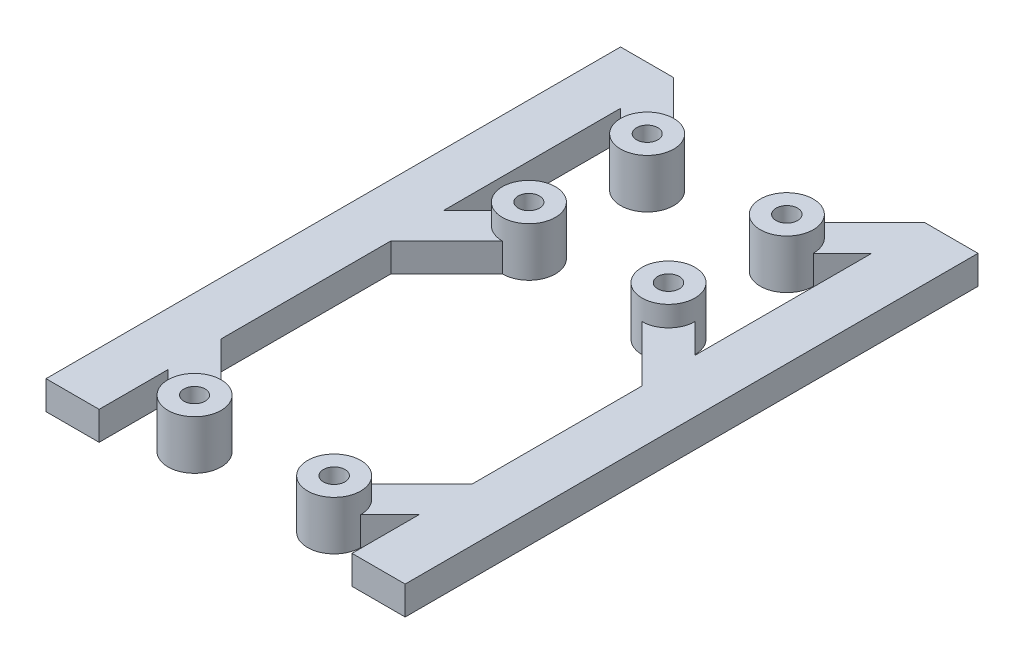
from build123d import *

# Parameters (mm, degrees)
SKETCH1_R              = 4.1275
SKETCH1_R_2            = 1.6764
BOSS_EXTRUDE1_DEPTH    = 3.175
BOSS_EXTRUDE1_2_DEPTH  = 3.175
BOSS_EXTRUDE1_3_DEPTH  = 3.175
BOSS_EXTRUDE1_4_DEPTH  = 3.175
BOSS_EXTRUDE1_5_DEPTH  = 3.175
BOSS_EXTRUDE1_6_DEPTH  = 3.175
BOSS_EXTRUDE1_7_DEPTH  = 3.175
BOSS_EXTRUDE1_8_DEPTH  = 3.175
BOSS_EXTRUDE1_9_DEPTH  = 3.175
BOSS_EXTRUDE1_10_DEPTH = 3.175
BOSS_EXTRUDE1_11_DEPTH = 3.175
BOSS_EXTRUDE1_12_DEPTH = 3.175
SKETCH2_R              = 1.6764
SKETCH2_R_2            = 1.597419346
BOSS_EXTRUDE2_DEPTH    = 4.445
SKETCH3_R              = 4.1275
SKETCH3_R_2            = 1.6764
BOSS_EXTRUDE3_DEPTH    = 6.35
SKETCH5_W              = 93.927077551
SKETCH5_H              = 52.017280011
CUT_EXTRUDE1_DEPTH     = 189.093566893
SKETCH6_W              = 99.512687727
SKETCH6_H              = 74.862867045
CUT_EXTRUDE3_DEPTH     = 189.006725097
SKETCH7_R              = 1.651
BOSS_EXTRUDE5_DEPTH    = 7.62
BOSS_EXTRUDE5_2_DEPTH  = 7.62
BOSS_EXTRUDE5_3_DEPTH  = 7.62
BOSS_EXTRUDE6_DEPTH    = 4.445
SKETCH10_W             = 53.220622609
SKETCH10_H             = 98.471007051
CUT_EXTRUDE4_DEPTH     = 139.402426653


with BuildPart() as part:
    # Sketch1 → Boss-Extrude1 (new body)
    with BuildSketch(Plane(origin=(0, 72.156669294, 0), x_dir=(-1, 0, 0), z_dir=(0, -1, 0))):
        with Locations(Location((-13.434351276, 13.879892008, 0), (0, 0, 90))):
            Circle(SKETCH1_R)
        with Locations(Location((-13.434351276, 13.879892008, 0), (0, 0, 90))):
            Circle(SKETCH1_R_2, mode=Mode.SUBTRACT)
    extrude(amount=BOSS_EXTRUDE1_DEPTH)



with BuildPart() as body_2:
    # Sketch1 → Boss-Extrude1 2 (new body)
    with BuildSketch(Plane(origin=(0, 72.156669294, 0), x_dir=(-1, 0, 0), z_dir=(0, -1, 0))):
        with Locations(Location((38.584848724, 13.879892008, 0), (0, 0, 90))):
            Circle(SKETCH1_R)
        with Locations(Location((38.584848724, 13.879892008, 0), (0, 0, 90))):
            Circle(SKETCH1_R_2, mode=Mode.SUBTRACT)
    extrude(amount=BOSS_EXTRUDE1_2_DEPTH)



with BuildPart() as body_3:
    # Sketch1 → Boss-Extrude1 3 (new body)
    with BuildSketch(Plane(origin=(0, 72.156669294, 0), x_dir=(-1, 0, 0), z_dir=(0, -1, 0))):
        with Locations(Location((-13.434351276, -38.088507992, 0), (0, 0, 90))):
            Circle(SKETCH1_R)
        with Locations(Location((-13.434351276, -38.088507992, 0), (0, 0, 90))):
            Circle(SKETCH1_R_2, mode=Mode.SUBTRACT)
    extrude(amount=BOSS_EXTRUDE1_3_DEPTH)


with BuildPart() as body_4:
    # Sketch1 → Boss-Extrude1 4 (new body)
    with BuildSketch(Plane(origin=(0, 72.156669294, 0), x_dir=(-1, 0, 0), z_dir=(0, -1, 0))):
        with Locations(Location((38.584848724, -38.088507992, 0), (0, 0, 90))):
            Circle(SKETCH1_R)
        with Locations(Location((38.584848724, -38.088507992, 0), (0, 0, 90))):
            Circle(SKETCH1_R_2, mode=Mode.SUBTRACT)
    extrude(amount=BOSS_EXTRUDE1_4_DEPTH)


with BuildPart() as body_5:
    # Sketch1 → Boss-Extrude1 5 (new body)
    with BuildSketch(Plane(origin=(0, 72.156669294, 0), x_dir=(-1, 0, 0), z_dir=(0, -1, 0))):
        with Locations(Location((-13.434351276, -56.478107992, 0), (0, 0, 90))):
            Circle(SKETCH1_R)
        with Locations(Location((-13.434351276, -56.478107992, 0), (0, 0, 90))):
            Circle(SKETCH1_R_2, mode=Mode.SUBTRACT)
    extrude(amount=BOSS_EXTRUDE1_5_DEPTH)


with BuildPart() as body_6:
    # Sketch1 → Boss-Extrude1 6 (new body)
    with BuildSketch(Plane(origin=(0, 72.156669294, 0), x_dir=(-1, 0, 0), z_dir=(0, -1, 0))):
        with Locations(Location((38.584848724, -56.478107992, 0), (0, 0, 90))):
            Circle(SKETCH1_R)
        with Locations(Location((38.584848724, -56.478107992, 0), (0, 0, 90))):
            Circle(SKETCH1_R_2, mode=Mode.SUBTRACT)
    extrude(amount=BOSS_EXTRUDE1_6_DEPTH)


with BuildPart() as body_7:
    # Sketch1 → Boss-Extrude1 7 (new body)
    with BuildSketch(Plane(origin=(0, 72.156669294, 0), x_dir=(-1, 0, 0), z_dir=(0, -1, 0))):
        with Locations(Location((-13.434351276, -108.446507992, 0), (0, 0, 90))):
            Circle(SKETCH1_R)
        with Locations(Location((-13.434351276, -108.446507992, 0), (0, 0, 90))):
            Circle(SKETCH1_R_2, mode=Mode.SUBTRACT)
    extrude(amount=BOSS_EXTRUDE1_7_DEPTH)


with BuildPart() as body_8:
    # Sketch1 → Boss-Extrude1 8 (new body)
    with BuildSketch(Plane(origin=(0, 72.156669294, 0), x_dir=(-1, 0, 0), z_dir=(0, -1, 0))):
        with Locations(Location((38.584848724, -108.446507992, 0), (0, 0, 90))):
            Circle(SKETCH1_R)
        with Locations(Location((38.584848724, -108.446507992, 0), (0, 0, 90))):
            Circle(SKETCH1_R_2, mode=Mode.SUBTRACT)
    extrude(amount=BOSS_EXTRUDE1_8_DEPTH)


with BuildPart() as body_9:
    # Sketch1 → Boss-Extrude1 9 (new body)
    with BuildSketch(Plane(origin=(0, 72.156669294, 0), x_dir=(-1, 0, 0), z_dir=(0, -1, 0))):
        with Locations(Location((-13.434351276, -126.836107992, 0), (0, 0, 90))):
            Circle(SKETCH1_R)
        with Locations(Location((-13.434351276, -126.836107992, 0), (0, 0, 90))):
            Circle(SKETCH1_R_2, mode=Mode.SUBTRACT)
    extrude(amount=BOSS_EXTRUDE1_9_DEPTH)


with BuildPart() as body_10:
    # Sketch1 → Boss-Extrude1 10 (new body)
    with BuildSketch(Plane(origin=(0, 72.156669294, 0), x_dir=(-1, 0, 0), z_dir=(0, -1, 0))):
        with Locations(Location((38.584848724, -126.836107992, 0), (0, 0, 90))):
            Circle(SKETCH1_R)
        with Locations(Location((38.584848724, -126.836107992, 0), (0, 0, 90))):
            Circle(SKETCH1_R_2, mode=Mode.SUBTRACT)
    extrude(amount=BOSS_EXTRUDE1_10_DEPTH)


with BuildPart() as body_11:
    # Sketch1 → Boss-Extrude1 11 (new body)
    with BuildSketch(Plane(origin=(0, 72.156669294, 0), x_dir=(-1, 0, 0), z_dir=(0, -1, 0))):
        with Locations(Location((-13.434351276, -178.804507992, 0), (0, 0, 90))):
            Circle(SKETCH1_R)
        with Locations(Location((-13.434351276, -178.804507992, 0), (0, 0, 90))):
            Circle(SKETCH1_R_2, mode=Mode.SUBTRACT)
    extrude(amount=BOSS_EXTRUDE1_11_DEPTH)


with BuildPart() as body_12:
    # Sketch1 → Boss-Extrude1 12 (new body)
    with BuildSketch(Plane(origin=(0, 72.156669294, 0), x_dir=(-1, 0, 0), z_dir=(0, -1, 0))):
        with Locations(Location((38.584848724, -178.804507992, 0), (0, 0, 90))):
            Circle(SKETCH1_R)
        with Locations(Location((38.584848724, -178.804507992, 0), (0, 0, 90))):
            Circle(SKETCH1_R_2, mode=Mode.SUBTRACT)
    extrude(amount=BOSS_EXTRUDE1_12_DEPTH)


with BuildPart() as body_2_1:
    add(body_2.part)

    add(body_3.part)  # Boss-Extrude2 merges body 3

    add(body_4.part)  # Boss-Extrude2 merges body 4

    add(body_5.part)  # Boss-Extrude2 merges body 5

    add(body_6.part)  # Boss-Extrude2 merges body 6

    add(body_7.part)  # Boss-Extrude2 merges body 7

    add(body_8.part)  # Boss-Extrude2 merges body 8

    add(body_9.part)  # Boss-Extrude2 merges body 9

    add(body_10.part)  # Boss-Extrude2 merges body 10

    add(body_11.part)  # Boss-Extrude2 merges body 11

    add(body_12.part)  # Boss-Extrude2 merges body 12
    # Sketch2 → Boss-Extrude2 (add)
    with BuildSketch(Plane(origin=(0, 68.981669294, 0), x_dir=(-1, 0, 0), z_dir=(0, -1, 0))):
        with BuildLine():
            Line((38.584848724, -174.677007992), (29.913944503, -166.01530123))
            Line((29.913944503, -166.01530123), (29.913944503, -139.625314754))
            Line((29.913944503, -139.625314754), (38.584848724, -130.963607992))
            ThreePointArc((38.584848724, -130.963607992), (41.503431963, -123.917524753), (34.457348724, -126.836107992))
            Line((34.457348724, -126.836107992), (29.913944503, -131.374692903))
            Line((29.913944503, -131.374692903), (29.913944503, -103.907923081))
            Line((29.913944503, -103.907923081), (34.457348724, -108.446507992))
            ThreePointArc((34.457348724, -108.446507992), (41.503431963, -111.365091232), (38.584848724, -104.319007992))
            Line((38.584848724, -104.319007992), (29.913944503, -95.65730123))
            Line((29.913944503, -95.65730123), (29.913944503, -69.267314754))
            Line((29.913944503, -69.267314754), (38.584848724, -60.605607992))
            ThreePointArc((38.584848724, -60.605607992), (41.503431963, -53.559524753), (34.457348724, -56.478107992))
            Line((34.457348724, -56.478107992), (29.913944503, -61.016692903))
            Line((29.913944503, -61.016692903), (29.913944503, -33.549923081))
            Line((29.913944503, -33.549923081), (34.457348724, -38.088507992))
            ThreePointArc((34.457348724, -38.088507992), (41.503431963, -41.007091232), (38.584848724, -33.961007992))
            Line((38.584848724, -33.961007992), (29.913944503, -25.29930123))
            Line((29.913944503, -25.29930123), (29.913944503, 1.090685246))
            Line((29.913944503, 1.090685246), (38.584848724, 9.752392008))
            ThreePointArc((38.584848724, 9.752392008), (41.503431963, 16.798475247), (34.457348724, 13.879892008))
            Line((34.457348724, 13.879892008), (12.575248724, -7.978997067))
            Line((12.575248724, -7.978997067), (-9.306851276, 13.879892008))
            ThreePointArc((-9.306851276, 13.879892008), (-10.515768037, 10.961308768), (-13.434351276, 9.752392008))
            Line((-13.434351276, 9.752392008), (-4.763447055, 1.090685246))
            Line((-4.763447055, 1.090685246), (-4.763447055, -25.29930123))
            Line((-4.763447055, -25.29930123), (-13.434351276, -33.961007992))
            ThreePointArc((-13.434351276, -33.961007992), (-16.352934515, -41.007091232), (-9.306851276, -38.088507992))
            Line((-9.306851276, -38.088507992), (-4.763447055, -33.549923081))
            Line((-4.763447055, -33.549923081), (-4.763447055, -61.016692903))
            Line((-4.763447055, -61.016692903), (-9.306851276, -56.478107992))
            ThreePointArc((-9.306851276, -56.478107992), (-16.352934515, -53.559524753), (-13.434351276, -60.605607992))
            Line((-13.434351276, -60.605607992), (-4.763447055, -69.267314754))
            Line((-4.763447055, -69.267314754), (-4.763447055, -95.65730123))
            Line((-4.763447055, -95.65730123), (-13.434351276, -104.319007992))
            ThreePointArc((-13.434351276, -104.319007992), (-16.352934515, -111.365091232), (-9.306851276, -108.446507992))
            Line((-9.306851276, -108.446507992), (-4.763447055, -103.907923081))
            Line((-4.763447055, -103.907923081), (-4.763447055, -131.374692903))
            Line((-4.763447055, -131.374692903), (-9.306851276, -126.836107992))
            ThreePointArc((-9.306851276, -126.836107992), (-16.352934515, -123.917524753), (-13.434351276, -130.963607992))
            Line((-13.434351276, -130.963607992), (-4.763447055, -139.625314754))
            Line((-4.763447055, -139.625314754), (-4.763447055, -166.01530123))
            Line((-4.763447055, -166.01530123), (-13.434351276, -174.677007992))
            ThreePointArc((-13.434351276, -174.677007992), (-16.352934515, -181.723091232), (-9.306851276, -178.804507992))
            Line((-9.306851276, -178.804507992), (12.575248724, -156.945618918))
            Line((12.575248724, -156.945618918), (34.457348724, -178.804507992))
            ThreePointArc((34.457348724, -178.804507992), (41.503431963, -181.723091232), (38.584848724, -174.677007992))
        make_face()
        with Locations(Location((-13.434351276, -178.804507992, 0), (0, 0, 90))):
            Circle(SKETCH2_R, mode=Mode.SUBTRACT)
        Polygon((8.445557325, -152.820307992), (3.495935743, -157.764679379), (3.495935743, -147.875936605), align=None, mode=Mode.SUBTRACT)
        with Locations(Location((-13.434351276, -126.836107992, 0), (0, 0, 90))):
            Circle(SKETCH2_R, mode=Mode.SUBTRACT)
        Polygon((16.704940123, -152.820307992), (21.654561705, -147.875936605), (21.654561705, -157.764679379), align=None, mode=Mode.SUBTRACT)
        with Locations(Location((38.584848724, -178.804507992, 0), (0, 0, 90))):
            Circle(SKETCH2_R, mode=Mode.SUBTRACT)
        with Locations(Location((38.584848724, -126.836107992, 0), (0, 0, 90))):
            Circle(SKETCH2_R, mode=Mode.SUBTRACT)
        with Locations(Location((38.584848724, -108.446507992, 0), (0, 0, 90))):
            Circle(SKETCH2_R, mode=Mode.SUBTRACT)
        with Locations(Location((-13.434351276, -56.478107992, 0), (0, 0, 90))):
            Circle(SKETCH2_R, mode=Mode.SUBTRACT)
        with Locations(Location((-13.434351276, -38.088507992, 0), (0, 0, 90))):
            Circle(SKETCH2_R, mode=Mode.SUBTRACT)
        Polygon((8.445557325, -12.104307992), (3.495935743, -17.048679379), (3.495935743, -7.159936605), align=None, mode=Mode.SUBTRACT)
        Polygon((3.495935743, -25.29930123), (12.575248724, -16.229618918), (21.654561705, -25.29930123), (21.654561705, -139.625314754), (12.575248724, -148.694997067), (3.495935743, -139.625314754), align=None, mode=Mode.SUBTRACT)
        with Locations(Location((38.584848724, -56.478107992, 0), (0, 0, 90))):
            Circle(SKETCH2_R, mode=Mode.SUBTRACT)
        with Locations(Location((38.584848724, -38.088507992, 0), (0, 0, 90))):
            Circle(SKETCH2_R, mode=Mode.SUBTRACT)
        Polygon((16.704940123, -12.104307992), (21.654561705, -7.159936605), (21.654561705, -17.048679379), align=None, mode=Mode.SUBTRACT)
        with Locations(Location((38.584848724, 13.879892008, 0), (0, 0, 90))):
            Circle(SKETCH2_R, mode=Mode.SUBTRACT)
        with Locations(Location((-13.434351276, -108.446507992, 0), (0, 0, 90))):
            Circle(SKETCH2_R_2, mode=Mode.SUBTRACT)
    extrude(amount=BOSS_EXTRUDE2_DEPTH)


with BuildPart() as part_1:
    add(part.part)

    add(body_2_1.part)  # Boss-Extrude3 merges body 2
    # Sketch3 → Boss-Extrude3 (add)
    with BuildSketch(Plane(origin=(0, 68.981669294, 0), x_dir=(-1, 0, 0), z_dir=(0, -1, 0))):
        with Locations(Location((-13.434351276, 13.879892008, 0), (0, 0, 90))):
            Circle(SKETCH3_R)
        with Locations(Location((-13.434351276, 13.879892008, 0), (0, 0, 90))):
            Circle(SKETCH3_R_2, mode=Mode.SUBTRACT)
    extrude(amount=BOSS_EXTRUDE3_DEPTH)

    # Sketch5 → Cut-Extrude1 (cut, through all)
    with BuildSketch(Plane(origin=(0, 72.156669294, 0), x_dir=(1, 0, 0), z_dir=(0, 1, 0))):
        with Locations((-6.446929607, 0.709338776)):
            Rectangle(SKETCH5_W, SKETCH5_H)
    extrude(amount=-CUT_EXTRUDE1_DEPTH, mode=Mode.SUBTRACT)

    # Sketch6 → Cut-Extrude3 (cut, through all)
    with BuildSketch(Plane(origin=(0, 72.156669294, 0), x_dir=(1, 0, 0), z_dir=(0, 1, 0))):
        with Locations((-14.039878686, -151.771582362)):
            Rectangle(SKETCH6_W, SKETCH6_H)
    extrude(amount=-CUT_EXTRUDE3_DEPTH, mode=Mode.SUBTRACT)


with BuildPart() as cut_extrude3_piece_1:
    # of the separate pieces the step leaves, piece 1, a body of its own (cut_extrude3_pieces)
    add(part_1.part.solids().sort_by_distance((9.306851276, 68.981669294, 108.446507992))[0])

    # Sketch10 → Cut-Extrude4 (cut, through all)
    with BuildSketch(Plane(origin=(0, 72.156669294, 0), x_dir=(1, 0, 0), z_dir=(0, 1, 0))):
        with Locations((18.323865827, -71.297393094)):
            Rectangle(SKETCH10_W, SKETCH10_H)
    extrude(amount=-CUT_EXTRUDE4_DEPTH, mode=Mode.SUBTRACT)


with BuildPart() as cut_extrude3_piece_2:
    # of the separate pieces the step leaves, piece 2, a body of its own (cut_extrude3_pieces)
    add(part_1.part.solids().sort_by_distance((-21.654561705, 68.981669294, 25.29930123))[0])


with BuildPart() as body_3_2:
    # Sketch7 → Boss-Extrude5 (new body)
    with BuildSketch(Plane(origin=(0, 72.156669294, 0), x_dir=(1, 0, 0), z_dir=(0, 1, 0))):
        with BuildLine():
            ThreePointArc((-56.159274687, -38.088507992), (-57.368191447, -35.169924753), (-60.286774687, -33.961007992))
            ThreePointArc((-60.286774687, -33.961007992), (-63.205357926, -35.169924753), (-64.414274687, -38.088507992))
            ThreePointArc((-64.414274687, -38.088507992), (-60.286774687, -42.216007992), (-56.159274687, -38.088507992))
        make_face()
        with Locations(Location((-60.286774687, -38.088507992, 0), (0, 0, 270))):
            Circle(SKETCH7_R, mode=Mode.SUBTRACT)
    extrude(amount=-BOSS_EXTRUDE5_DEPTH)



with BuildPart() as body_4_2:
    # Sketch7 → Boss-Extrude5 2 (new body)
    with BuildSketch(Plane(origin=(0, 72.156669294, 0), x_dir=(1, 0, 0), z_dir=(0, 1, 0))):
        with BuildLine():
            ThreePointArc((-56.159274687, -56.478107992), (-60.286774687, -52.350607992), (-64.414274687, -56.478107992))
            ThreePointArc((-64.414274687, -56.478107992), (-63.205357926, -59.396691232), (-60.286774687, -60.605607992))
            ThreePointArc((-60.286774687, -60.605607992), (-57.368191447, -59.396691232), (-56.159274687, -56.478107992))
        make_face()
        with Locations(Location((-60.286774687, -56.478107992, 0), (0, 0, 270))):
            Circle(SKETCH7_R, mode=Mode.SUBTRACT)
    extrude(amount=-BOSS_EXTRUDE5_2_DEPTH)


with BuildPart() as body_5_2:
    # Sketch7 → Boss-Extrude5 3 (new body)
    with BuildSketch(Plane(origin=(0, 72.156669294, 0), x_dir=(1, 0, 0), z_dir=(0, 1, 0))):
        with BuildLine():
            ThreePointArc((-60.286774687, -104.319007992), (-63.205357926, -105.527924753), (-64.414274687, -108.446507992))
            ThreePointArc((-64.414274687, -108.446507992), (-60.286774687, -112.574007992), (-56.159274687, -108.446507992))
            ThreePointArc((-56.159274687, -108.446507992), (-57.368191447, -105.527924753), (-60.286774687, -104.319007992))
        make_face()
        with Locations(Location((-60.286774687, -108.446507992, 0), (0, 0, 270))):
            Circle(SKETCH7_R, mode=Mode.SUBTRACT)
    extrude(amount=-BOSS_EXTRUDE5_3_DEPTH)


with BuildPart() as body_3_2_1:
    add(body_3_2.part)

    add(body_4_2.part)  # Boss-Extrude6 merges body 4 2

    add(body_5_2.part)  # Boss-Extrude6 merges body 5 2
    # Sketch9 → Boss-Extrude6 (add)
    with BuildSketch(Plane(origin=(0, 68.981669294, 0), x_dir=(1, 0, 0), z_dir=(0, 1, 0))):
        with BuildLine():
            Line((-68.957678907, -25.29930123), (-77.217061705, -25.29930123))
            Line((-77.217061705, -25.29930123), (-77.217061705, -114.606686913))
            Line((-77.217061705, -114.606686913), (-68.957678907, -114.606686913))
            Line((-68.957678907, -114.606686913), (-68.957678907, -103.907923081))
            Line((-68.957678907, -103.907923081), (-64.414274687, -108.446507992))
            ThreePointArc((-64.414274687, -108.446507992), (-63.205357926, -105.527924753), (-60.286774687, -104.319007992))
            Line((-60.286774687, -104.319007992), (-68.957678907, -95.65730123))
            Line((-68.957678907, -95.65730123), (-68.957678907, -69.267314754))
            Line((-68.957678907, -69.267314754), (-60.286774687, -60.605607992))
            ThreePointArc((-60.286774687, -60.605607992), (-63.205357926, -59.396691232), (-64.414274687, -56.478107992))
            Line((-64.414274687, -56.478107992), (-68.957678907, -61.016692903))
            Line((-68.957678907, -61.016692903), (-68.957678907, -33.549923081))
            Line((-68.957678907, -33.549923081), (-64.414274687, -38.088507992))
            ThreePointArc((-64.414274687, -38.088507992), (-63.205357926, -35.169924753), (-60.286774687, -33.961007992))
            Line((-60.286774687, -33.961007992), (-68.957678907, -25.29930123))
        make_face()
    extrude(amount=-BOSS_EXTRUDE6_DEPTH)


solid = Compound([cut_extrude3_piece_2.part, body_3_2_1.part])
